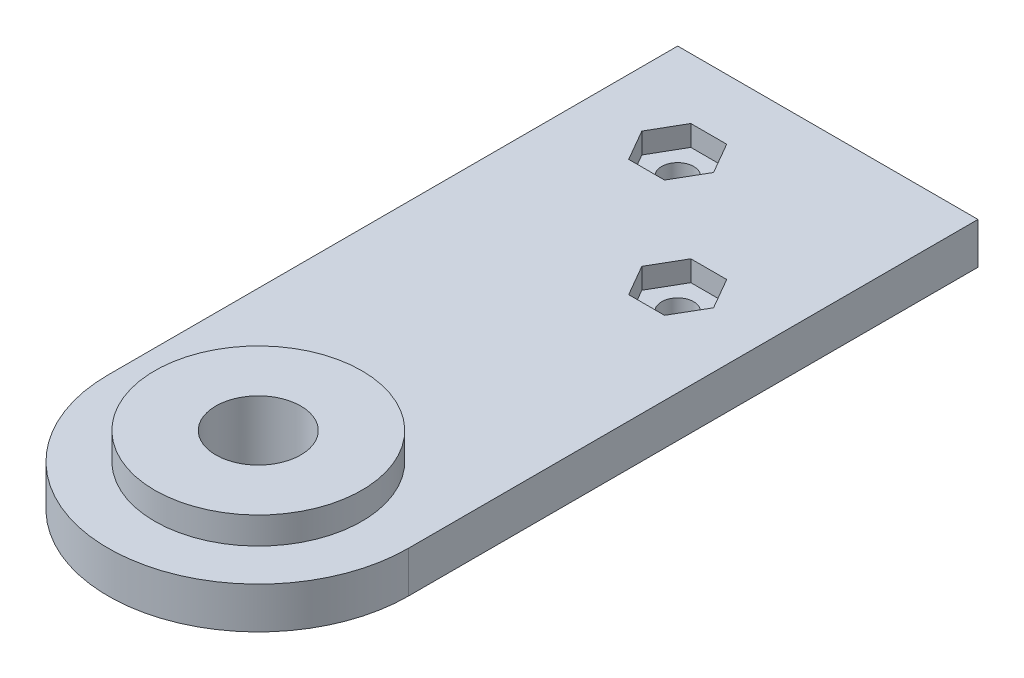
from build123d import *

# Parameters (mm, degrees)
SKETCH1_W           = 50
SKETCH1_H           = 50
BOSS_EXTRUDE1_DEPTH = 4
SKETCH2_R           = 4.1
CUT_EXTRUDE1_DEPTH  = 4
SKETCH5_R           = 10
SKETCH5_R_2         = 4.1
BOSS_EXTRUDE4_DEPTH = 2.6
SKETCH6_OUTSIDE_W   = 66.204
SKETCH6_OUTSIDE_H   = 66.204
CUT_EXTRUDE3_DEPTH  = 4
SKETCH7_W           = 29
SKETCH7_H           = 4
BOSS_EXTRUDE5_DEPTH = 30
SKETCH8_R           = 1.55
CUT_EXTRUDE4_DEPTH  = 4
CUT_EXTRUDE5_DEPTH  = 2


with BuildPart() as part:
    # Sketch1 → Boss-Extrude1 (new body)
    with BuildSketch(Plane(origin=(0, 0, 0), x_dir=(1, 0, 0), z_dir=(0, 1, 0))):
        with Locations((-21.122518296, -46.495755178)):
            Rectangle(SKETCH1_W, SKETCH1_H)
    extrude(amount=BOSS_EXTRUDE1_DEPTH)

    # Sketch2 → Cut-Extrude1 (cut)
    with BuildSketch(Plane.XZ):
        with Locations(Location((-21.122518296, 46.495755178, 0), (0, 0, 270))):
            Circle(SKETCH2_R)
    extrude(amount=-CUT_EXTRUDE1_DEPTH, mode=Mode.SUBTRACT)

    # Sketch5 → Boss-Extrude4 (add)
    with BuildSketch(Plane(origin=(0, 4, 0), x_dir=(1, 0, 0), z_dir=(0, 1, 0))):
        with Locations(Location((-21.122518296, -46.495755178, 0), (0, 0, 270))):
            Circle(SKETCH5_R)
        with Locations(Location((-21.122518296, -46.495755178, 0), (0, 0, 90))):
            Circle(SKETCH5_R_2, mode=Mode.SUBTRACT)
    extrude(amount=BOSS_EXTRUDE4_DEPTH)

    # Sketch6 outside → Cut-Extrude3 (cut)
    with BuildSketch(Plane.XZ):
        with Locations((-21.123, 46.496)):
            Rectangle(SKETCH6_OUTSIDE_W, SKETCH6_OUTSIDE_H)
        with BuildLine():
            Line((-35.622518296, 46.495755178), (-35.622518296, 21.495755178))
            Line((-35.622518296, 21.495755178), (-6.622518296, 21.495755178))
            Line((-6.622518296, 21.495755178), (-6.622518296, 46.495755178))
            ThreePointArc((-6.622518296, 46.495755178), (-21.122518296, 60.995755178), (-35.622518296, 46.495755178))
        make_face(mode=Mode.SUBTRACT)
    extrude(amount=-CUT_EXTRUDE3_DEPTH, mode=Mode.SUBTRACT)

    # Sketch7 → Boss-Extrude5 (add)
    with BuildSketch(Plane(origin=(0, 0, 21.495755178), x_dir=(-1, 0, 0), z_dir=(0, 0, -1))):
        with Locations((21.122518296, 2)):
            Rectangle(SKETCH7_W, SKETCH7_H)
    extrude(amount=BOSS_EXTRUDE5_DEPTH)

    # Sketch8 → Cut-Extrude4 (cut)
    with BuildSketch(Plane(origin=(0, 4, 0), x_dir=(1, 0, 0), z_dir=(0, 1, 0))):
        with Locations(Location((-26.779372546, -0.338900928, 0), (0, 0, 270))):
            Circle(SKETCH8_R)
        with Locations(Location((-15.465664047, -11.652609427, 0), (0, 0, 270))):
            Circle(SKETCH8_R)
    extrude(amount=-CUT_EXTRUDE4_DEPTH, mode=Mode.SUBTRACT)

    # Sketch9 → Cut-Extrude5 (cut)
    with BuildSketch(Plane(origin=(0, 4, 0), x_dir=(1, 0, 0), z_dir=(0, 1, 0))):
        Polygon((-25.047321738, 2.661099072), (-28.511423353, 2.661099072), (-30.243474161, -0.338900928), (-28.511423353, -3.338900928), (-25.047321738, -3.338900928), (-23.315270931, -0.338900928), align=None)
        Polygon((-13.733613239, -8.652609427), (-17.197714854, -8.652609427), (-18.929765662, -11.652609427), (-17.197714854, -14.652609427), (-13.733613239, -14.652609427), (-12.001562432, -11.652609427), align=None)
    extrude(amount=-CUT_EXTRUDE5_DEPTH, mode=Mode.SUBTRACT)


solid = part.part
